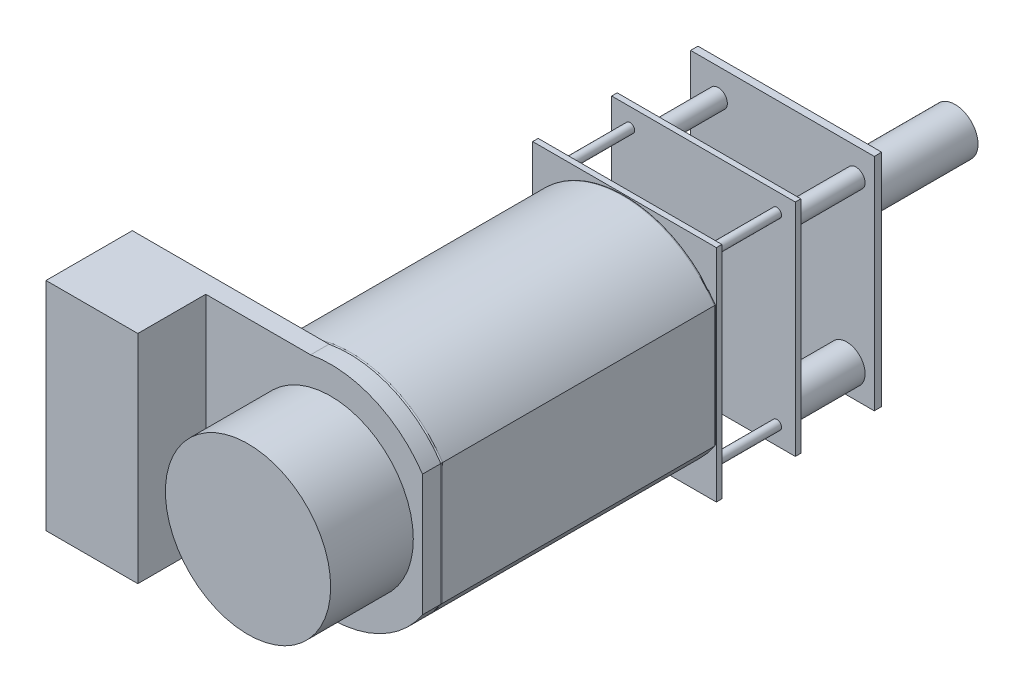
from build123d import *

# Parameters (mm, degrees)
BOSS_EXTRUDE1_DEPTH  = 15
FILLET1_R            = 0.1
SKETCH2_R            = 2.5
BOSS_EXTRUDE2_DEPTH  = 1
SKETCH3_R            = 1.25
BOSS_EXTRUDE3_DEPTH  = 0.1
SKETCH4_W            = 10
SKETCH4_H            = 12
BOSS_EXTRUDE4_DEPTH  = 0.3
SKETCH5_R            = 0.5
BOSS_EXTRUDE5_DEPTH  = 1
SKETCH6_R            = 0.5
BOSS_EXTRUDE6_DEPTH  = 0.5
SKETCH8_R            = 0.25
BOSS_EXTRUDE7_DEPTH  = 4
SKETCH9_W            = 10
SKETCH9_H            = 12
BOSS_EXTRUDE8_DEPTH  = 0.3
SKETCH10_R           = 0.5
SKETCH10_R_2         = 1
BOSS_EXTRUDE9_DEPTH  = 4
SKETCH11_W           = 10
SKETCH11_H           = 12
BOSS_EXTRUDE10_DEPTH = 0.4
BOSS_EXTRUDE11_START = 9
SKETCH14_R           = 1.25
BOSS_EXTRUDE11_DEPTH = 9
SKETCH15_R           = 1.5
BOSS_EXTRUDE12_DEPTH = 0.8
BOSS_EXTRUDE13_DEPTH = 1
SKETCH17_R           = 4.5
BOSS_EXTRUDE14_DEPTH = 4.5
SKETCH18_W           = 5
SKETCH18_H           = 11.8
BOSS_EXTRUDE15_DEPTH = 3.7
SKETCH19_W           = 4.1
SKETCH19_H           = 11.6
CUT_EXTRUDE1_DEPTH   = 3.2


with BuildPart() as part:
    # Sketch1 → Boss-Extrude1 (new body)
    with BuildSketch(Plane.XY):
        with BuildLine():
            Line((-5, -3.31662479), (-5, 3.31662479))
            ThreePointArc((-5, 3.31662479), (0, 6), (5, 3.31662479))
            Line((5, 3.31662479), (5, -3.31662479))
            ThreePointArc((5, -3.31662479), (0, -6), (-5, -3.31662479))
        make_face()
    extrude(amount=BOSS_EXTRUDE1_DEPTH)

    # Fillet1
    fillet1_edges = [part.edges().sort_by_distance(p)[0] for p in [
        (0, 6, 15),
        (-5, 0, 15),
        (0, -6, 15),
        (-5, 0, 0),
        (0, 6, 0),
        (5, 0, 0),
        (0, -6, 0),
        (5, 0, 15),
    ]]
    fillet(fillet1_edges, radius=FILLET1_R)

    # Sketch2 → Boss-Extrude2 (add)
    with BuildSketch(Plane.XY.offset(15)):
        Circle(SKETCH2_R)
    extrude(amount=BOSS_EXTRUDE2_DEPTH)

    # Sketch3 → Boss-Extrude3 (add)
    with BuildSketch(Plane.XY.offset(16)):
        Circle(SKETCH3_R)
    extrude(amount=BOSS_EXTRUDE3_DEPTH)

    # Sketch4 → Boss-Extrude4 (add)
    with BuildSketch(Plane(origin=(0, 0, 0), x_dir=(-1, 0, 0), z_dir=(0, 0, -1))):
        Rectangle(SKETCH4_W, SKETCH4_H)
    extrude(amount=BOSS_EXTRUDE4_DEPTH)

    # Sketch5 → Boss-Extrude5 (add)
    with BuildSketch(Plane(origin=(0, 0, -0.3), x_dir=(-1, 0, 0), z_dir=(0, 0, -1))):
        with Locations(Location((0, 0, 0), (0, 0, 180))):
            Circle(SKETCH5_R)
    extrude(amount=BOSS_EXTRUDE5_DEPTH)

    # Sketch6 → Boss-Extrude6 (add)
    with BuildSketch(Plane(origin=(0, 0, -0.3), x_dir=(-1, 0, 0), z_dir=(0, 0, -1))):
        with BuildLine():
            Line((-0.1, 1.496662955), (0, 1.669868035))
            Line((0, 1.669868035), (0.1, 1.496662955))
            ThreePointArc((0.1, 1.496662955), (0.134458963, 1.493961441), (0.168846531, 1.490466655))
            Line((0.168846531, 1.490466655), (0.298166451, 1.643032569))
            Line((0.298166451, 1.643032569), (0.365632449, 1.454755276))
            ThreePointArc((0.365632449, 1.454755276), (0.399055268, 1.445944291), (0.432266195, 1.43636553))
            Line((0.432266195, 1.43636553), (0.586749587, 1.563388684))
            Line((0.586749587, 1.563388684), (0.619513169, 1.366090565))
            ThreePointArc((0.619513169, 1.366090565), (0.650825609, 1.351453302), (0.681792469, 1.336098436))
            Line((0.681792469, 1.336098436), (0.856474109, 1.433496201))
            Line((0.856474109, 1.433496201), (0.853482227, 1.23351858))
            ThreePointArc((0.853482227, 1.23351858), (0.881677878, 1.213525492), (0.909405371, 1.192888038))
            Line((0.909405371, 1.192888038), (1.098670848, 1.25752997))
            Line((1.098670848, 1.25752997), (1.060019664, 1.061300293))
            ThreePointArc((1.060019664, 1.061300293), (1.084192296, 1.036593973), (1.107789236, 1.011337237))
            Line((1.107789236, 1.011337237), (1.305555402, 1.041145691))
            Line((1.305555402, 1.041145691), (1.232487197, 0.854970941))
            ThreePointArc((1.232487197, 0.854970941), (1.251859881, 0.826345472), (1.270567844, 0.797281226))
            Line((1.270567844, 0.797281226), (1.470478331, 0.791298132))
            Line((1.470478331, 0.791298132), (1.365341577, 0.621162119))
            ThreePointArc((1.365341577, 0.621162119), (1.379291659, 0.589537547), (1.392509356, 0.557599939))
            Line((1.392509356, 0.557599939), (1.588138876, 0.516017601))
            Line((1.588138876, 0.516017601), (1.454312755, 0.367388636))
            ThreePointArc((1.454312755, 0.367388636), (1.462391868, 0.333781401), (1.469694472, 0.299996932))
            Line((1.469694472, 0.299996932), (1.654755332, 0.22415184))
            Line((1.654755332, 0.22415184), (1.496541125, 0.10180698))
            ThreePointArc((1.496541125, 0.10180698), (1.4984896, 0.067297246), (1.499642398, 0.032751777))
            Line((1.499642398, 0.032751777), (1.668186589, -0.074918346))
            Line((1.668186589, -0.074918346), (1.490669432, -0.167046836))
            ThreePointArc((1.490669432, -0.167046836), (1.486424643, -0.201349899), (1.481390583, -0.235546047))
            Line((1.481390583, -0.235546047), (1.628000957, -0.371580595))
            Line((1.628000957, -0.371580595), (1.436886396, -0.43053163))
            ThreePointArc((1.436886396, -0.43053163), (1.426584774, -0.463525492), (1.415525656, -0.496273228))
            Line((1.415525656, -0.496273228), (1.535490035, -0.656299937))
            Line((1.535490035, -0.656299937), (1.33692065, -0.680178782))
            ThreePointArc((1.33692065, -0.680178782), (1.320893298, -0.710802994), (1.30416457, -0.741049779))
            Line((1.30416457, -0.741049779), (1.3936272, -0.91992526))
            Line((1.3936272, -0.91992526), (1.193985174, -0.907964429))
            ThreePointArc((1.193985174, -0.907964429), (1.172747224, -0.935234703), (1.150886561, -0.96200838))
            Line((1.150886561, -0.96200838), (1.206972039, -1.153983428))
            Line((1.206972039, -1.153983428), (1.012674032, -1.106567353))
            ThreePointArc((1.012674032, -1.106567353), (0.986908089, -1.129607199), (0.960618112, -1.15204724))
            Line((0.960618112, -1.15204724), (0.981523805, -1.350951619))
            Line((0.981523805, -1.350951619), (0.798814713, -1.26960429))
            ThreePointArc((0.798814713, -1.26960429), (0.769348916, -1.28767319), (0.739474606, -1.305058354))
            Line((0.739474606, -1.305058354), (0.724528587, -1.504499113))
            Line((0.724528587, -1.504499113), (0.559280832, -1.391835102))
            ThreePointArc((0.559280832, -1.391835102), (0.527062236, -1.404352306), (0.494563777, -1.416123819))
            Line((0.494563777, -1.416123819), (0.444246425, -1.609690768))
            Line((0.444246425, -1.609690768), (0.301771205, -1.469331188))
            ThreePointArc((0.301771205, -1.469331188), (0.267835342, -1.475894383), (0.233757262, -1.481673899))
            Line((0.233757262, -1.481673899), (0.149685817, -1.663145638))
            Line((0.149685817, -1.663145638), (0.034562404, -1.499601761))
            ThreePointArc((0.034562404, -1.499601761), (0, -1.5), (-0.034562404, -1.499601761))
            Line((-0.034562404, -1.499601761), (-0.149685817, -1.663145638))
            Line((-0.149685817, -1.663145638), (-0.233757262, -1.481673899))
            ThreePointArc((-0.233757262, -1.481673899), (-0.267835342, -1.475894383), (-0.301771205, -1.469331188))
            Line((-0.301771205, -1.469331188), (-0.444246425, -1.609690768))
            Line((-0.444246425, -1.609690768), (-0.494563777, -1.416123819))
            ThreePointArc((-0.494563777, -1.416123819), (-0.527062236, -1.404352306), (-0.559280832, -1.391835102))
            Line((-0.559280832, -1.391835102), (-0.724528587, -1.504499113))
            Line((-0.724528587, -1.504499113), (-0.739474606, -1.305058354))
            ThreePointArc((-0.739474606, -1.305058354), (-0.769348916, -1.28767319), (-0.798814713, -1.26960429))
            Line((-0.798814713, -1.26960429), (-0.981523805, -1.350951619))
            Line((-0.981523805, -1.350951619), (-0.960618112, -1.15204724))
            ThreePointArc((-0.960618112, -1.15204724), (-0.986908089, -1.129607199), (-1.012674032, -1.106567353))
            Line((-1.012674032, -1.106567353), (-1.206972039, -1.153983428))
            Line((-1.206972039, -1.153983428), (-1.150886561, -0.96200838))
            ThreePointArc((-1.150886561, -0.96200838), (-1.172747224, -0.935234703), (-1.193985174, -0.907964429))
            Line((-1.193985174, -0.907964429), (-1.3936272, -0.91992526))
            Line((-1.3936272, -0.91992526), (-1.30416457, -0.741049779))
            ThreePointArc((-1.30416457, -0.741049779), (-1.320893298, -0.710802994), (-1.33692065, -0.680178782))
            Line((-1.33692065, -0.680178782), (-1.535490035, -0.656299937))
            Line((-1.535490035, -0.656299937), (-1.415525656, -0.496273228))
            ThreePointArc((-1.415525656, -0.496273228), (-1.426584774, -0.463525492), (-1.436886396, -0.43053163))
            Line((-1.436886396, -0.43053163), (-1.628000957, -0.371580595))
            Line((-1.628000957, -0.371580595), (-1.481390583, -0.235546047))
            ThreePointArc((-1.481390583, -0.235546047), (-1.486424643, -0.201349899), (-1.490669432, -0.167046836))
            Line((-1.490669432, -0.167046836), (-1.668186589, -0.074918346))
            Line((-1.668186589, -0.074918346), (-1.499642398, 0.032751777))
            ThreePointArc((-1.499642398, 0.032751777), (-1.4984896, 0.067297246), (-1.496541125, 0.10180698))
            Line((-1.496541125, 0.10180698), (-1.654755332, 0.22415184))
            Line((-1.654755332, 0.22415184), (-1.469694472, 0.299996932))
            ThreePointArc((-1.469694472, 0.299996932), (-1.462391868, 0.333781401), (-1.454312755, 0.367388636))
            Line((-1.454312755, 0.367388636), (-1.588138876, 0.516017601))
            Line((-1.588138876, 0.516017601), (-1.392509356, 0.557599939))
            ThreePointArc((-1.392509356, 0.557599939), (-1.379291659, 0.589537547), (-1.365341577, 0.621162119))
            Line((-1.365341577, 0.621162119), (-1.470478331, 0.791298132))
            Line((-1.470478331, 0.791298132), (-1.270567844, 0.797281226))
            ThreePointArc((-1.270567844, 0.797281226), (-1.251859881, 0.826345472), (-1.232487197, 0.854970941))
            Line((-1.232487197, 0.854970941), (-1.305555402, 1.041145691))
            Line((-1.305555402, 1.041145691), (-1.107789236, 1.011337237))
            ThreePointArc((-1.107789236, 1.011337237), (-1.084192296, 1.036593973), (-1.060019664, 1.061300293))
            Line((-1.060019664, 1.061300293), (-1.098670848, 1.25752997))
            Line((-1.098670848, 1.25752997), (-0.909405371, 1.192888038))
            ThreePointArc((-0.909405371, 1.192888038), (-0.881677878, 1.213525492), (-0.853482227, 1.23351858))
            Line((-0.853482227, 1.23351858), (-0.856474109, 1.433496201))
            Line((-0.856474109, 1.433496201), (-0.681792469, 1.336098436))
            ThreePointArc((-0.681792469, 1.336098436), (-0.650825609, 1.351453302), (-0.619513169, 1.366090565))
            Line((-0.619513169, 1.366090565), (-0.586749587, 1.563388684))
            Line((-0.586749587, 1.563388684), (-0.432266195, 1.43636553))
            ThreePointArc((-0.432266195, 1.43636553), (-0.399055268, 1.445944291), (-0.365632449, 1.454755276))
            Line((-0.365632449, 1.454755276), (-0.298166451, 1.643032569))
            Line((-0.298166451, 1.643032569), (-0.168846531, 1.490466655))
            ThreePointArc((-0.168846531, 1.490466655), (-0.134458963, 1.493961441), (-0.1, 1.496662955))
        make_face()
        Circle(SKETCH6_R, mode=Mode.SUBTRACT)
    extrude(amount=BOSS_EXTRUDE6_DEPTH)

    # Sketch8 → Boss-Extrude7 (add)
    with BuildSketch(Plane(origin=(0, 0, -0.3), x_dir=(-1, 0, 0), z_dir=(0, 0, -1))):
        with Locations(Location((-4, 5, 0), (0, 0, 180))):
            Circle(SKETCH8_R)
        with Locations(Location((4, 5, 0), (0, 0, 180))):
            Circle(SKETCH8_R)
        with Locations(Location((4, -5, 0), (0, 0, 180))):
            Circle(SKETCH8_R)
        with Locations(Location((-4, -5, 0), (0, 0, 180))):
            Circle(SKETCH8_R)
    extrude(amount=BOSS_EXTRUDE7_DEPTH)

    # Sketch9 → Boss-Extrude8 (add)
    with BuildSketch(Plane(origin=(0, 0, -4.3), x_dir=(-1, 0, 0), z_dir=(0, 0, -1))):
        Rectangle(SKETCH9_W, SKETCH9_H)
    extrude(amount=BOSS_EXTRUDE8_DEPTH)

    # Sketch10 → Boss-Extrude9 (add)
    with BuildSketch(Plane(origin=(0, 0, -4.6), x_dir=(-1, 0, 0), z_dir=(0, 0, -1))):
        with Locations(Location((-4, 4.5, 0), (0, 0, 180))):
            Circle(SKETCH10_R)
        with Locations(Location((-3.5, -4.5, 0), (0, 0, 180))):
            Circle(SKETCH10_R_2)
        with Locations(Location((3.5, 4.5, 0), (0, 0, 180))):
            Circle(SKETCH10_R)
    extrude(amount=BOSS_EXTRUDE9_DEPTH)

    # Sketch11 → Boss-Extrude10 (add)
    with BuildSketch(Plane(origin=(0, 0, -8.6), x_dir=(-1, 0, 0), z_dir=(0, 0, -1))):
        Rectangle(SKETCH11_W, SKETCH11_H)
    extrude(amount=BOSS_EXTRUDE10_DEPTH)

    # Sketch14 → Boss-Extrude11 (add)
    with BuildSketch(Plane(origin=(0, 0, -9), x_dir=(-1, 0, 0), z_dir=(0, 0, -1)).offset(BOSS_EXTRUDE11_START)):
        with Locations(Location((0, 0, 0), (0, 0, 180))):
            Circle(SKETCH14_R)
    extrude(amount=-BOSS_EXTRUDE11_DEPTH)

    # Sketch15 → Boss-Extrude12 (add)
    with BuildSketch(Plane(origin=(0, 0, -9), x_dir=(-1, 0, 0), z_dir=(0, 0, -1))):
        with Locations(Location((0, 0, 0), (0, 0, 180))):
            Circle(SKETCH15_R)
    extrude(amount=BOSS_EXTRUDE12_DEPTH)

    # Sketch16 → Boss-Extrude13 (add)
    with BuildSketch(Plane.XY.offset(15)):
        with BuildLine():
            Line((5, -3.31662479), (5, 3.31662479))
            ThreePointArc((5, 3.31662479), (2.342814299, 5.523696331), (-1.090871211, 5.9))
            Line((-1.090871211, 5.9), (-11.8, 5.9))
            Line((-11.8, 5.9), (-11.8, -5.9))
            Line((-11.8, -5.9), (-1.090871211, -5.9))
            ThreePointArc((-1.090871211, -5.9), (2.342814299, -5.523696331), (5, -3.31662479))
        make_face()
    extrude(amount=BOSS_EXTRUDE13_DEPTH)

    # Sketch17 → Boss-Extrude14 (add)
    with BuildSketch(Plane.XY.offset(16)):
        Circle(SKETCH17_R)
    extrude(amount=BOSS_EXTRUDE14_DEPTH)

    # Sketch18 → Boss-Extrude15 (add)
    with BuildSketch(Plane.XY.offset(16)):
        with Locations((-9.3, 0)):
            Rectangle(SKETCH18_W, SKETCH18_H)
    extrude(amount=BOSS_EXTRUDE15_DEPTH)

    # Sketch19 → Cut-Extrude1 (cut)
    with BuildSketch(Plane.ZY.offset(11.8)):
        with Locations((17.55, 0)):
            Rectangle(SKETCH19_W, SKETCH19_H)
    extrude(amount=-CUT_EXTRUDE1_DEPTH, mode=Mode.SUBTRACT)


solid = part.part
